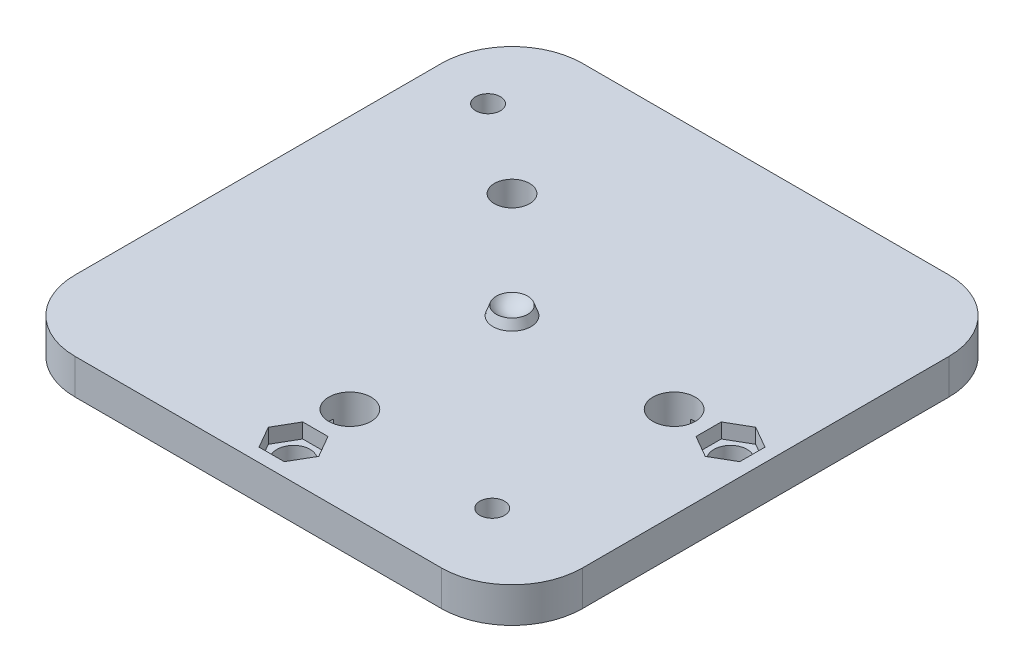
from build123d import *

# Parameters (mm, degrees)
SKETCH4_W           = 72
SKETCH4_H           = 72
SKETCH4_R           = 3
SKETCH4_R_2         = 2.5
SKETCH4_R_3         = 2.35
BOSS_EXTRUDE2_DEPTH = 5
SKETCH5_W           = 10.4
SKETCH5_H           = 1.2
SKETCH5_W_2         = 1.2
SKETCH5_H_2         = 10.4
CUT_EXTRUDE1_DEPTH  = 2
CUT_EXTRUDE2_DEPTH  = 2.1
FILLET1_R           = 10
SKETCH7_R           = 1.75
CUT_EXTRUDE3_DEPTH  = 5
SKETCH8_R           = 1.75
CUT_EXTRUDE4_DEPTH  = 5


with BuildPart() as part:
    # Sketch3 → Revolve1 (revolve)
    with BuildSketch(Plane.XY, mode=Mode.PRIVATE) as revolve1_sk:
        with BuildLine():
            Line((0, 0), (2.7, 0))
            Line((2.7, 0), (2.233206222, 1.282505364))
            ThreePointArc((2.233206222, 1.282505364), (1.26348021, 0.413869711), (0, 0.1))
            Line((0, 0.1), (0, 0))
        make_face()
    revolve(revolve1_sk.sketch.rotate(Axis((0, 0.1, 0), (0, -1, 0)), 90), axis=Axis((0, 0.1, 0), (0, -1, 0)))

    # Sketch4 → Boss-Extrude2 (add)
    with BuildSketch(Plane.XZ):
        Rectangle(SKETCH4_W, SKETCH4_H)
        with Locations(Location((23, 0, 0), (0, 0, 270))):
            Circle(SKETCH4_R, mode=Mode.SUBTRACT)
        with Locations(Location((0, 23, 0), (0, 0, 270))):
            Circle(SKETCH4_R, mode=Mode.SUBTRACT)
        with Locations(Location((-15, -15, 0), (0, 0, 270))):
            Circle(SKETCH4_R_2, mode=Mode.SUBTRACT)
        with Locations(Location((0, 31, 0), (0, 0, 270))):
            Circle(SKETCH4_R_3, mode=Mode.SUBTRACT)
        with Locations(Location((31, 0, 0), (0, 0, 270))):
            Circle(SKETCH4_R_3, mode=Mode.SUBTRACT)
    extrude(amount=BOSS_EXTRUDE2_DEPTH)

    # Sketch5 → Cut-Extrude1 (cut)
    with BuildSketch(Plane.XZ.offset(5)):
        with Locations((0, 23)):
            Rectangle(SKETCH5_W, SKETCH5_H)
        with Locations((23, 0)):
            Rectangle(SKETCH5_W_2, SKETCH5_H_2)
        Polygon((-18.252691193, -10.898780669), (-10.898780669, -18.252691193), (-11.747308807, -19.101219331), (-19.101219331, -11.747308807), align=None)
    extrude(amount=-CUT_EXTRUDE1_DEPTH, mode=Mode.SUBTRACT)

    # Sketch6 → Cut-Extrude2 (cut)
    with BuildSketch(Plane(origin=(0, 0, 0), x_dir=(1, 0, 0), z_dir=(0, 1, 0))):
        Polygon((1.789785834, -27.9), (-1.789785834, -27.9), (-3.579571669, -31), (-1.789785834, -34.1), (1.789785834, -34.1), (3.579571669, -31), align=None)
        Polygon((34.1, 1.789785834), (31, 3.579571669), (27.9, 1.789785834), (27.9, -1.789785834), (31, -3.579571669), (34.1, -1.789785834), align=None)
    extrude(amount=-CUT_EXTRUDE2_DEPTH, mode=Mode.SUBTRACT)

    # Fillet1
    fillet1_edges = [part.edges().sort_by_distance(p)[0] for p in [
        (36, -2.5, -36),
        (36, -2.5, 36),
        (-36, -2.5, 36),
        (-36, -2.5, -36),
    ]]
    fillet(fillet1_edges, radius=FILLET1_R)

    # Sketch7 → Cut-Extrude3 (cut)
    with BuildSketch(Plane.XZ.offset(5)):
        with Locations(Location((22.26, 25.07, 0), (0, 0, 270))):
            Circle(SKETCH7_R)
    extrude(amount=-CUT_EXTRUDE3_DEPTH, mode=Mode.SUBTRACT)

    # Sketch8 → Cut-Extrude4 (cut)
    with BuildSketch(Plane.XZ.offset(5)):
        with Locations(Location((-27.74, -24.34, 0), (0, 0, 270))):
            Circle(SKETCH8_R)
    extrude(amount=-CUT_EXTRUDE4_DEPTH, mode=Mode.SUBTRACT)


solid = part.part
